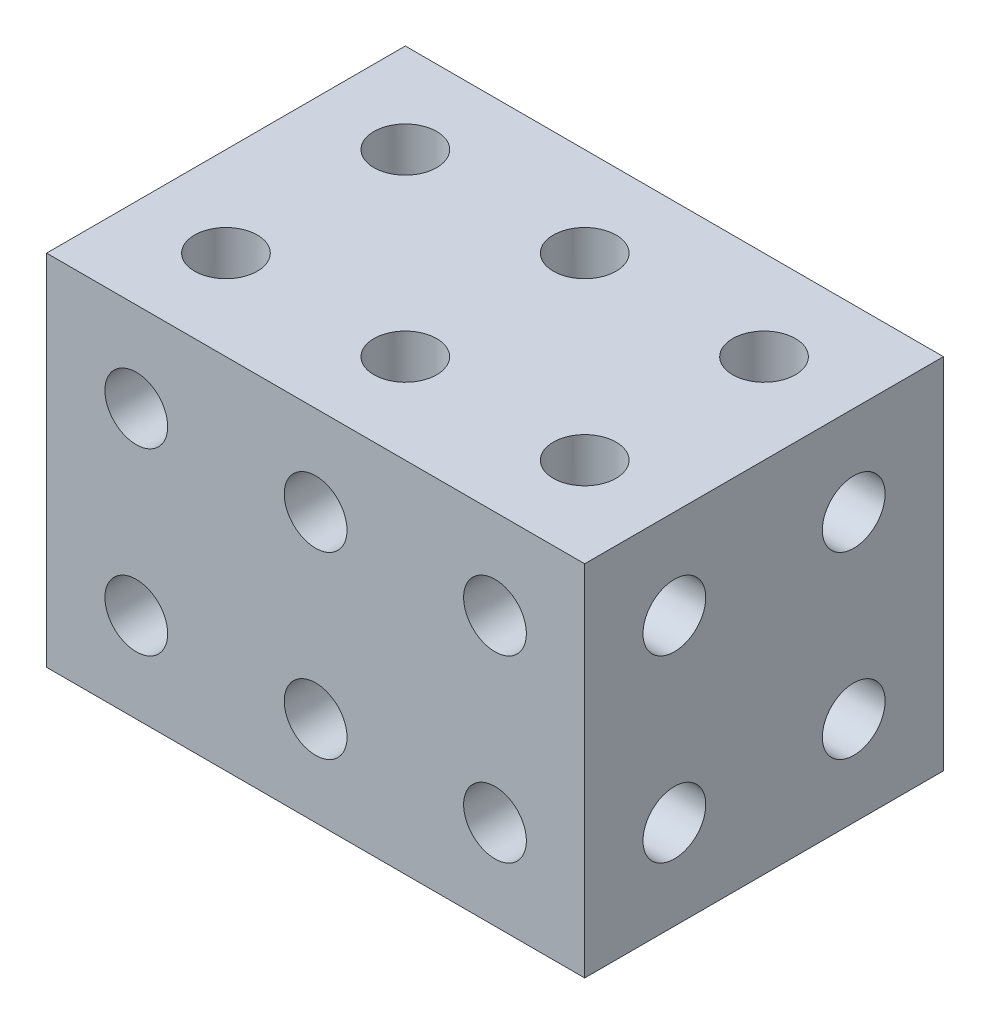
from build123d import *

# Parameters (mm, degrees)
ESQUISSE1_W             = 20
ESQUISSE1_H             = 20
BOSS_EXTRU_1_DEPTH      = 30
ESQUISSE2_R             = 1.75
ENL_V_MAT_EXTRU_1_DEPTH = 42.231056256
ESQUISSE3_R             = 1.75
ENL_V_MAT_EXTRU_2_DEPTH = 40
ESQUISSE4_R             = 1.75
ENL_V_MAT_EXTRU_3_DEPTH = 40


with BuildPart() as part:
    # Esquisse1 → Boss.-Extru.1 (new body)
    with BuildSketch(Plane(origin=(0, 0, 0), x_dir=(0, 0, -1), z_dir=(1, 0, 0))):
        with Locations((10, 10)):
            Rectangle(ESQUISSE1_W, ESQUISSE1_H)
    extrude(amount=BOSS_EXTRU_1_DEPTH)

    # Esquisse2 → Enlèv. mat.-Extru.1 (cut, through all)
    with BuildSketch(Plane(origin=(0, 20, 0), x_dir=(1, 0, 0), z_dir=(0, 1, 0))):
        with Locations(Location((5, 15, 0), (0, 0, 270))):
            Circle(ESQUISSE2_R)
        with Locations(Location((15, 15, 0), (0, 0, 270))):
            Circle(ESQUISSE2_R)
        with Locations(Location((25, 15, 0), (0, 0, 270))):
            Circle(ESQUISSE2_R)
        with Locations((35, 15)):
            Circle(ESQUISSE2_R)
        with Locations(Location((5, 5, 0), (0, 0, 270))):
            Circle(ESQUISSE2_R)
        with Locations(Location((15, 5, 0), (0, 0, 270))):
            Circle(ESQUISSE2_R)
        with Locations(Location((25, 5, 0), (0, 0, 270))):
            Circle(ESQUISSE2_R)
        with Locations((35, 5)):
            Circle(ESQUISSE2_R)
        with Locations((5, -5)):
            Circle(ESQUISSE2_R)
        with Locations((15, -5)):
            Circle(ESQUISSE2_R)
        with Locations((25, -5)):
            Circle(ESQUISSE2_R)
        with Locations((35, -5)):
            Circle(ESQUISSE2_R)
        with Locations((5, -15)):
            Circle(ESQUISSE2_R)
        with Locations((15, -15)):
            Circle(ESQUISSE2_R)
        with Locations((25, -15)):
            Circle(ESQUISSE2_R)
        with Locations((35, -15)):
            Circle(ESQUISSE2_R)
    extrude(amount=-ENL_V_MAT_EXTRU_1_DEPTH, mode=Mode.SUBTRACT)

    # Esquisse3 → Enlèv. mat.-Extru.2 (cut)
    with BuildSketch(Plane.XY):
        with Locations((5, 15)):
            Circle(ESQUISSE3_R)
        with Locations((15, 15)):
            Circle(ESQUISSE3_R)
        with Locations((25, 15)):
            Circle(ESQUISSE3_R)
        with Locations((35, 15)):
            Circle(ESQUISSE3_R)
        with Locations((5, 5)):
            Circle(ESQUISSE3_R)
        with Locations((15, 5)):
            Circle(ESQUISSE3_R)
        with Locations((25, 5)):
            Circle(ESQUISSE3_R)
        with Locations((35, 5)):
            Circle(ESQUISSE3_R)
    extrude(amount=-ENL_V_MAT_EXTRU_2_DEPTH, mode=Mode.SUBTRACT)

    # Esquisse4 → Enlèv. mat.-Extru.3 (cut)
    with BuildSketch(Plane(origin=(30, 0, 0), x_dir=(0, 0, -1), z_dir=(1, 0, 0))):
        with Locations((5, 15)):
            Circle(ESQUISSE4_R)
        with Locations(Location((15, 15, 0), (0, 0, 315))):
            Circle(ESQUISSE4_R)
        with Locations((25, 15)):
            Circle(ESQUISSE4_R)
        with Locations((35, 15)):
            Circle(ESQUISSE4_R)
        with Locations((5, 5)):
            Circle(ESQUISSE4_R)
        with Locations((15, 5)):
            Circle(ESQUISSE4_R)
    extrude(amount=-ENL_V_MAT_EXTRU_3_DEPTH, mode=Mode.SUBTRACT)


solid = part.part
